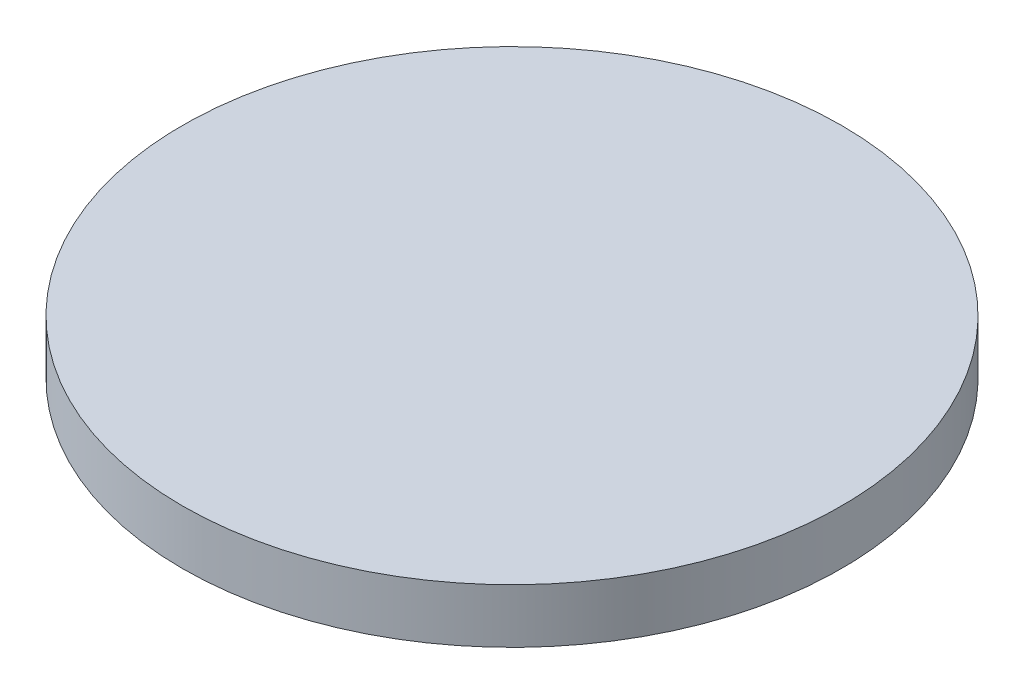
from build123d import *

# Parameters (mm, degrees)
SKETCH1_R           = 8.5
BOSS_EXTRUDE1_DEPTH = 1.4


with BuildPart() as part:
    # Sketch1 → Boss-Extrude1 (new body)
    with BuildSketch(Plane(origin=(0, 0, 0), x_dir=(1, 0, 0), z_dir=(0, 1, 0))):
        with Locations(Location((0, 0, 0), (0, 0, 270))):
            Circle(SKETCH1_R)
    extrude(amount=BOSS_EXTRUDE1_DEPTH)


solid = part.part
